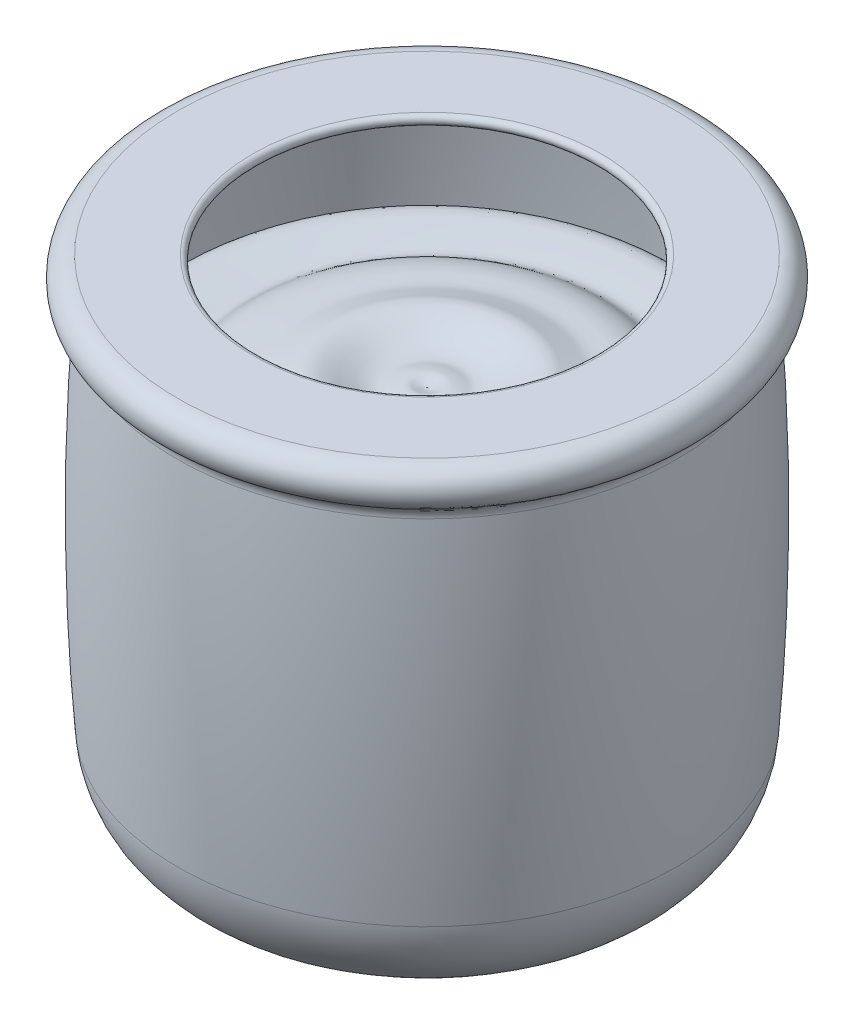
from build123d import *


with BuildPart() as part:
    # Çizim1 → Döndür1 (revolve)
    with BuildSketch(Plane.XY):
        with BuildLine():
            Line((0, -100), (-30, -100))
            ThreePointArc((-30, -100), (-43.607104187, -94.657650413), (-49.944817631, -81.484671564))
            ThreePointArc((-49.944817631, -81.484671564), (-51.321810614, -45.969827462), (-50.172416041, -10.446889051))
            ThreePointArc((-50.172416041, -10.446889051), (-50.557330856, -8.760989517), (-51.808859586, -7.567636052))
            ThreePointArc((-51.808859586, -7.567636052), (-53.890407704, -3.070092533), (-50, 0))
            Line((-50, 0), (-35, 0))
            ThreePointArc((-35, 0), (-34, -1), (-35, -2))
            Line((-35, -2), (-50, -2))
            ThreePointArc((-50, -2), (-51.945203852, -3.535046267), (-50.904429793, -5.783818026))
            ThreePointArc((-50.904429793, -5.783818026), (-48.818548577, -7.772740467), (-48.177023884, -10.582573024))
            ThreePointArc((-48.177023884, -10.582573024), (-49.321820879, -45.963419682), (-47.950335868, -81.336204408))
            ThreePointArc((-47.950335868, -81.336204408), (-42.246393768, -93.191885372), (-30, -98))
            Line((-30, -98), (0, -98))
            Line((0, -98), (0, -100))
        make_face()
    revolve(axis=Axis((0, 0, 0), (0, -1, 0)))


with BuildPart() as body_2:
    # Çizim2 → Döndür2 (revolve)
    with BuildSketch(Plane.XY, mode=Mode.PRIVATE) as d_nd_r2_sk:
        with BuildLine():
            Line((0, -23.014608353), (0, -98))
            Line((0, -98), (-30, -98))
            ThreePointArc((-30, -98), (-42.246393768, -93.191885372), (-47.950335868, -81.336204408))
            ThreePointArc((-47.950335868, -81.336204408), (-48.836132622, -66.414489157), (-49.273690105, -51.472910747))
            add(Edge.make_bspline(
                [(-49.273690105, -51.472910747), (-52.002193469, -39.395021193), (-28.81337953, -26.3541201), (-51.699729812, -35.217727255), (-50.313083213, -21.663899187), (-36.816071025, -27.441223093), (-34.099702866, -23.715162924), (-28.426091093, -22.174341567), (-22.821856988, -22.613366752), (-16.682449271, -18.676498172), (-11.312741088, -22.524974321), (-6.04068484, -23.480386073), (-2.806195913, -21.582568498), (-0.136205946, -23.634367026), (0, -23.014608353)],
                knots=[0, 0, 0, 0, 0.213884844, 0.246678372, 0.327935286, 0.403878951, 0.467501401, 0.559410996, 0.637707534, 0.717662259, 0.850740783, 0.888841054, 0.950998682, 1, 1, 1, 1], degree=3))
        make_face()
    revolve(d_nd_r2_sk.sketch.rotate(Axis((0, -23.014608353, 0), (0, -1, 0)), 270), axis=Axis((0, -23.014608353, 0), (0, -1, 0)))


solid = Compound([part.part, body_2.part])
